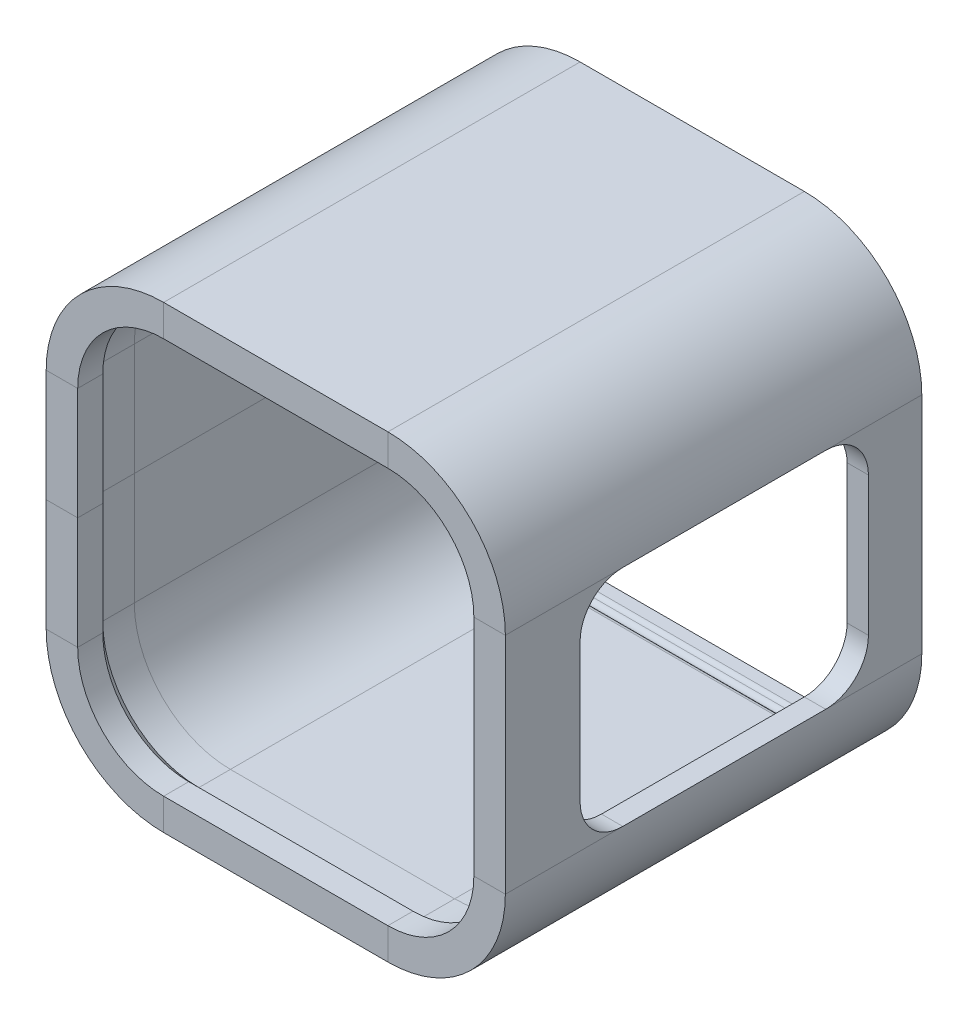
from build123d import *

# Parameters (mm, degrees)
POWER_BUTTON_HOLE_DEPTH = 2


with BuildPart() as part:
    # Case 2: sweep along a path in Sketch1
    with BuildLine(Plane.XY) as case_2_path:
        Line((-10.5, -19.25), (10.5, -19.25))
        ThreePointArc((10.5, -19.25), (16.687184335, -16.687184335), (19.25, -10.5))
        Line((19.25, -10.5), (19.25, 10.5))
        ThreePointArc((19.25, 10.5), (16.687184335, 16.687184335), (10.5, 19.25))
        Line((10.5, 19.25), (-10.5, 19.25))
        ThreePointArc((-10.5, 19.25), (-16.687184335, 16.687184335), (-19.25, 10.5))
        Line((-19.25, 10.5), (-19.25, -10.5))
        ThreePointArc((-19.25, -10.5), (-16.687184335, -16.687184335), (-10.5, -19.25))
    # Sketch4 → Case 2 (sweep)
    with BuildSketch(Plane(origin=(0, 0, 0), x_dir=(1, 0, 0), z_dir=(0, 1, 0))):
        with BuildLine():
            Line((-19.5, 0), (-19.5, -3))
            Line((-19.5, -3), (-19.45, -3))
            Line((-19.45, -3), (-18.55, -3.9))
            Line((-18.55, -3.9), (-18.55, -6.25))
            Line((-18.55, -6.25), (-21.5, -6.25))
            Line((-21.5, -6.25), (-21.5, 32.75))
            Line((-21.5, 32.75), (-19.5, 32.75))
            Line((-19.5, 32.75), (-19.5, 31.616025404))
            ThreePointArc((-19.5, 31.616025404), (-19.566987298, 31.366025404), (-19.75, 31.183012702))
            ThreePointArc((-19.75, 31.183012702), (-20, 30.75), (-19.75, 30.316987298))
            ThreePointArc((-19.75, 30.316987298), (-19.566987298, 30.133974596), (-19.5, 29.883974596))
            Line((-19.5, 29.883974596), (-19.5, 0))
        make_face()
    sweep(path=case_2_path.line)

    # Sketch6 → Power Button Hole (cut)
    with BuildSketch(Plane(origin=(21.5, 0, 0), x_dir=(0, 0, -1), z_dir=(1, 0, 0))):
        with BuildLine():
            Line((23.75, 10.5), (4.75, 10.5))
            ThreePointArc((4.75, 10.5), (1.921572875, 9.328427125), (0.75, 6.5))
            Line((0.75, 6.5), (0.75, -6.5))
            ThreePointArc((0.75, -6.5), (1.921572875, -9.328427125), (4.75, -10.5))
            Line((4.75, -10.5), (23.75, -10.5))
            ThreePointArc((23.75, -10.5), (26.578427125, -9.328427125), (27.75, -6.5))
            Line((27.75, -6.5), (27.75, 6.5))
            ThreePointArc((27.75, 6.5), (26.578427125, 9.328427125), (23.75, 10.5))
        make_face()
    extrude(amount=-POWER_BUTTON_HOLE_DEPTH, mode=Mode.SUBTRACT)


solid = part.part
